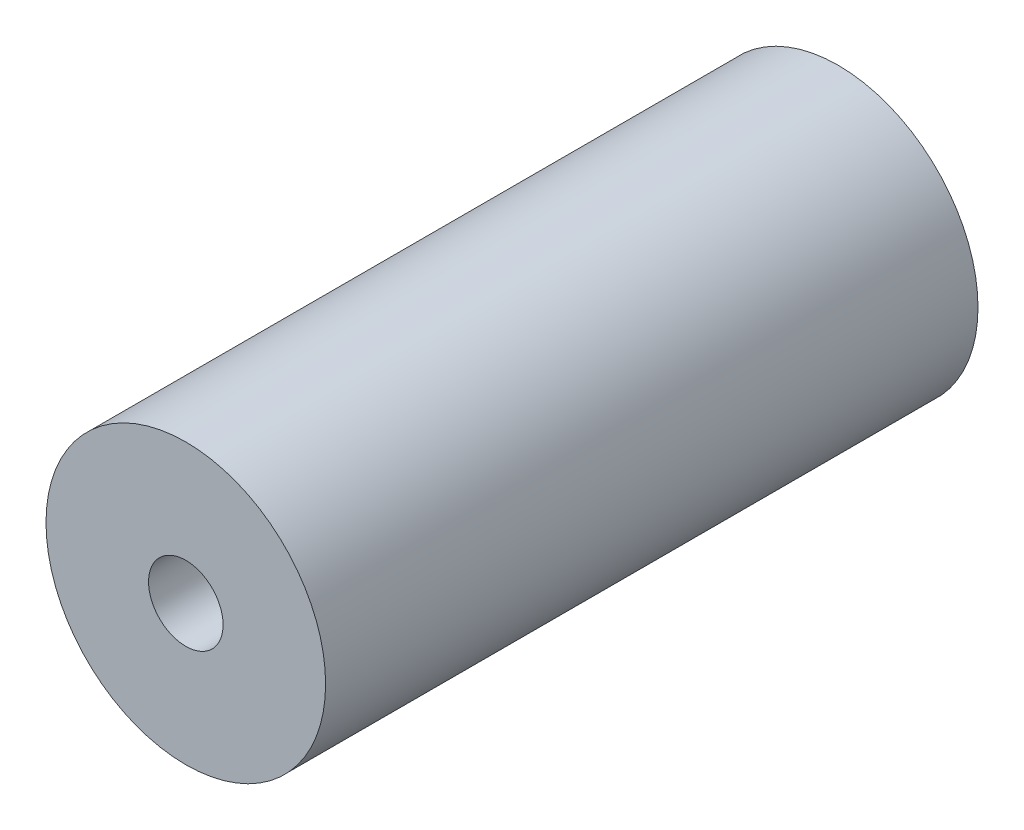
from build123d import *

# Parameters (mm, degrees)
SKETCH1_R           = 3
SKETCH1_R_2         = 0.8
BOSS_EXTRUDE1_DEPTH = 14


with BuildPart() as part:
    # Sketch1 → Boss-Extrude1 (new body)
    with BuildSketch(Plane.XY):
        Circle(SKETCH1_R)
        Circle(SKETCH1_R_2, mode=Mode.SUBTRACT)
    extrude(amount=BOSS_EXTRUDE1_DEPTH)


solid = part.part
